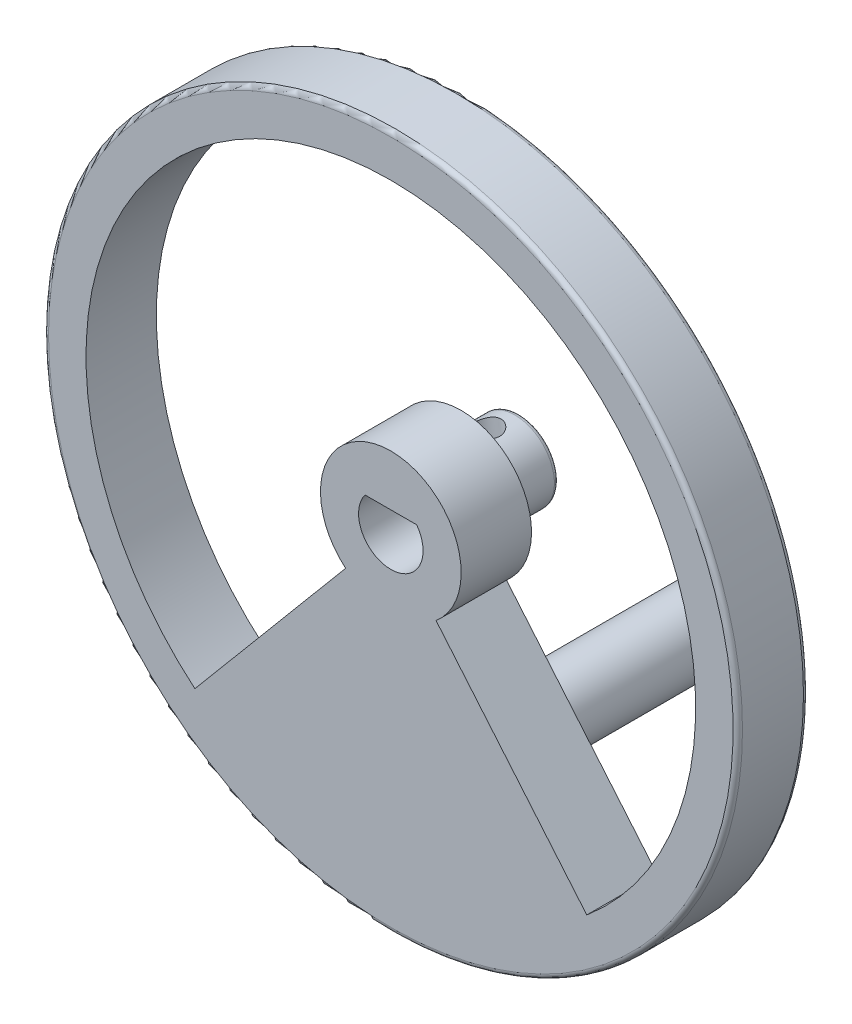
from build123d import *

# Parameters (mm, degrees)
ESQUISSE2_R             = 14.79822015
BOSS_EXTRU_1_DEPTH      = 3
CONG_2_R                = 0.2
CONG_3_R                = 0.2
ESQUISSE3_R             = 1.5
BOSS_EXTRU_2_DEPTH      = 13
CONG_4_R                = 0.5
ENL_V_MAT_EXTRU_1_DEPTH = 3.5
ESQUISSE5_R             = 1.675
BOSS_EXTRU_3_DEPTH      = 2.5
ENL_V_START             = -5
ENL_V_MAT_EXTRU_2_DEPTH = 5
CONG_6_R                = 0.2
ESQUISSE8_R             = 2
ESQUISSE8_R_2           = 1.5
BOSS_EXTRU_4_DEPTH      = 2.5
CONG_7_R                = 0.2
ENL_V_MAT_EXTRU_3_REACH = 27.888
ESQUISSE14_W            = 6.151008923
ESQUISSE14_H            = 1.920006843
ENL_V_MAT_EXTRU_4_DEPTH = 1.5


with BuildPart() as part:
    # Esquisse2 → Boss.-Extru.1 (new body)
    with BuildSketch(Plane(origin=(0, 0, 2), x_dir=(-1, 0, 0), z_dir=(0, 0, -1))):
        with Locations((0, -2)):
            Circle(ESQUISSE2_R)
    extrude(amount=BOSS_EXTRU_1_DEPTH)

    # Congé2
    cong_2_edges = [part.edges().sort_by_distance(p)[0] for p in [
        (14.79822015, -2, -1),
    ]]
    fillet(cong_2_edges, radius=CONG_2_R)

    # Congé3
    cong_3_edges = [part.edges().sort_by_distance(p)[0] for p in [
        (14.79822015, -2, 2),
    ]]
    fillet(cong_3_edges, radius=CONG_3_R)

    # Esquisse3 → Boss.-Extru.2 (add)
    with BuildSketch(Plane(origin=(0, 0, -1), x_dir=(-1, 0, 0), z_dir=(0, 0, -1))):
        with Locations(Location((0, -12, 0), (0, 0, 180))):
            Circle(ESQUISSE3_R)
    extrude(amount=BOSS_EXTRU_2_DEPTH)

    # Congé4
    cong_4_edges = [part.edges().sort_by_distance(p)[0] for p in [
        (-1.5, -12, -14),
    ]]
    fillet(cong_4_edges, radius=CONG_4_R)

    # Esquisse4 → Enlèv. mat.-Extru.1 (cut)
    with BuildSketch(Plane(origin=(0, 0, -1), x_dir=(-1, 0, 0), z_dir=(0, 0, -1))):
        with BuildLine():
            Line((-1.1, -1.175), (1.1, -1.175))
            ThreePointArc((1.1, -1.175), (0, -3.375), (-1.1, -1.175))
        make_face()
    extrude(amount=-ENL_V_MAT_EXTRU_1_DEPTH, mode=Mode.SUBTRACT)

    # Esquisse5 → Boss.-Extru.3 (add)
    with BuildSketch(Plane(origin=(0, 0, -1), x_dir=(-1, 0, 0), z_dir=(0, 0, -1))):
        with Locations((0, -2)):
            Circle(ESQUISSE5_R)
    extrude(amount=BOSS_EXTRU_3_DEPTH)

    # Esquisse6 → Enlèv. mat.-Extru.2 (cut)
    with BuildSketch(Plane.XY.offset(2).offset(ENL_V_START)):
        with BuildLine():
            Line((1.1, -1.175), (-1.1, -1.175))
            ThreePointArc((-1.1, -1.175), (0, -3.375), (1.1, -1.175))
        make_face()
    extrude(amount=ENL_V_MAT_EXTRU_2_DEPTH, mode=Mode.SUBTRACT)

    # Congé6
    cong_6_edges = [part.edges().sort_by_distance(p)[0] for p in [
        (1.675, -2, -3.5),
    ]]
    fillet(cong_6_edges, radius=CONG_6_R)

    # Esquisse8 → Boss.-Extru.4 (add)
    with BuildSketch(Plane(origin=(0, 0, -1), x_dir=(-1, 0, 0), z_dir=(0, 0, -1))):
        with Locations((0, -12)):
            Circle(ESQUISSE8_R)
        with Locations(Location((0, -12, 0), (0, 0, 180))):
            Circle(ESQUISSE8_R_2, mode=Mode.SUBTRACT)
    extrude(amount=BOSS_EXTRU_4_DEPTH)

    # Congé7
    cong_7_edges = [part.edges().sort_by_distance(p)[0] for p in [
        (2, -12, -3.5),
    ]]
    fillet(cong_7_edges, radius=CONG_7_R)

    # Esquisse9 → Trou taraudé M1.61 (revolve, cut)
    with BuildSketch(Plane(origin=(0.228696217, -3.659314027, -2.244412235), x_dir=(0.9906352400032369, 0.1365350550727882, 0), z_dir=(0, 0, 1))):
        Polygon((0, 0), (0, 18.355114173), (0.625, 18.355114173), (0.625, 0.2), (0.825, 0), align=None)
    revolve(axis=Axis((1.095693817, -9.949847801, -2.244412235), (-0.13653505507278818, 0.9906352400032369, 0)), mode=Mode.SUBTRACT)

    # Esquisse11 → Enlèv. mat.-Extru.3 (cut, up to next)
    with BuildSketch(Plane(origin=(0, 0, -1), x_dir=(-1, 0, 0), z_dir=(0, 0, -1)), mode=Mode.PRIVATE) as enl_v_mat_extru_3_sk1:
        with BuildLine():
            Line((-1.928362829, -4.298133329), (-8.356238926, -11.958577761))
            ThreePointArc((-8.356238926, -11.958577761), (0, 11), (8.356238926, -11.958577761))
            Line((8.356238926, -11.958577761), (1.928362829, -4.298133329))
            ThreePointArc((1.928362829, -4.298133329), (0, 1), (-1.928362829, -4.298133329))
        make_face()
    enl_v_mat_extru_3_tool1 = extrude(enl_v_mat_extru_3_sk1.sketch, amount=-ENL_V_MAT_EXTRU_3_REACH, mode=Mode.PRIVATE) & part.part
    add(enl_v_mat_extru_3_tool1.solids().sort_by_distance((-5.408009, -7.9054, -1))[0], mode=Mode.SUBTRACT)

    # Esquisse14 → Enlèv. mat.-Extru.4 (cut)
    with BuildSketch(Plane(origin=(0, 0, -14), x_dir=(-1, 0, 0), z_dir=(0, 0, -1))):
        with Locations((-0.122541976, -11.039996579)):
            Rectangle(ESQUISSE14_W, ESQUISSE14_H)
    extrude(amount=-ENL_V_MAT_EXTRU_4_DEPTH, mode=Mode.SUBTRACT)


solid = part.part
